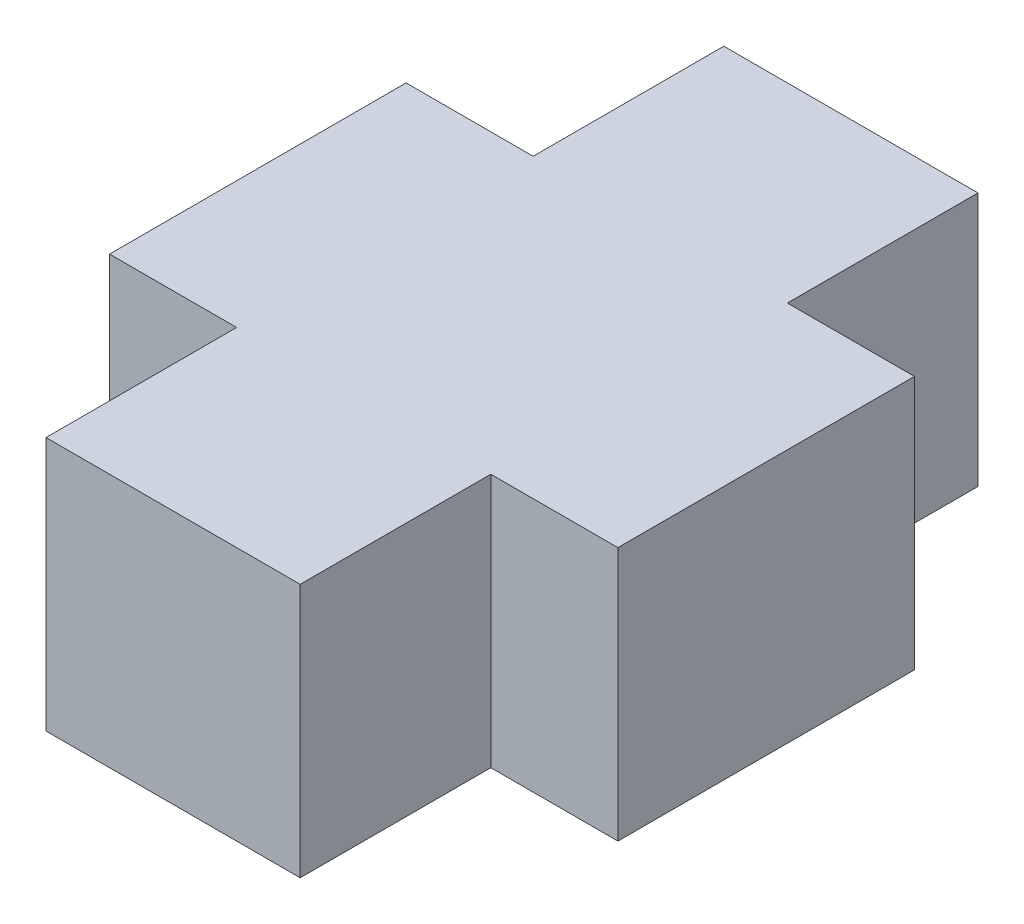
from build123d import *

# Parameters (mm, degrees)
SKETCH1_W           = 76.2
SKETCH1_H           = 88.9
SKETCH1_H_2         = 57.15
SKETCH1_W_2         = 38.1
BOSS_EXTRUDE1_DEPTH = 76.2


with BuildPart() as part:
    # Sketch1 → Boss-Extrude1 (new body)
    with BuildSketch(Plane(origin=(0, 0, 0), x_dir=(1, 0, 0), z_dir=(0, 1, 0))):
        Rectangle(SKETCH1_W, SKETCH1_H)
        with Locations((0, 73.025)):
            Rectangle(SKETCH1_W, SKETCH1_H_2)
        with Locations((57.15, 0)):
            Rectangle(SKETCH1_W_2, SKETCH1_H)
        with Locations((0, -73.025)):
            Rectangle(SKETCH1_W, SKETCH1_H_2)
        with Locations((-57.15, 0)):
            Rectangle(SKETCH1_W_2, SKETCH1_H)
    extrude(amount=BOSS_EXTRUDE1_DEPTH)


solid = part.part
